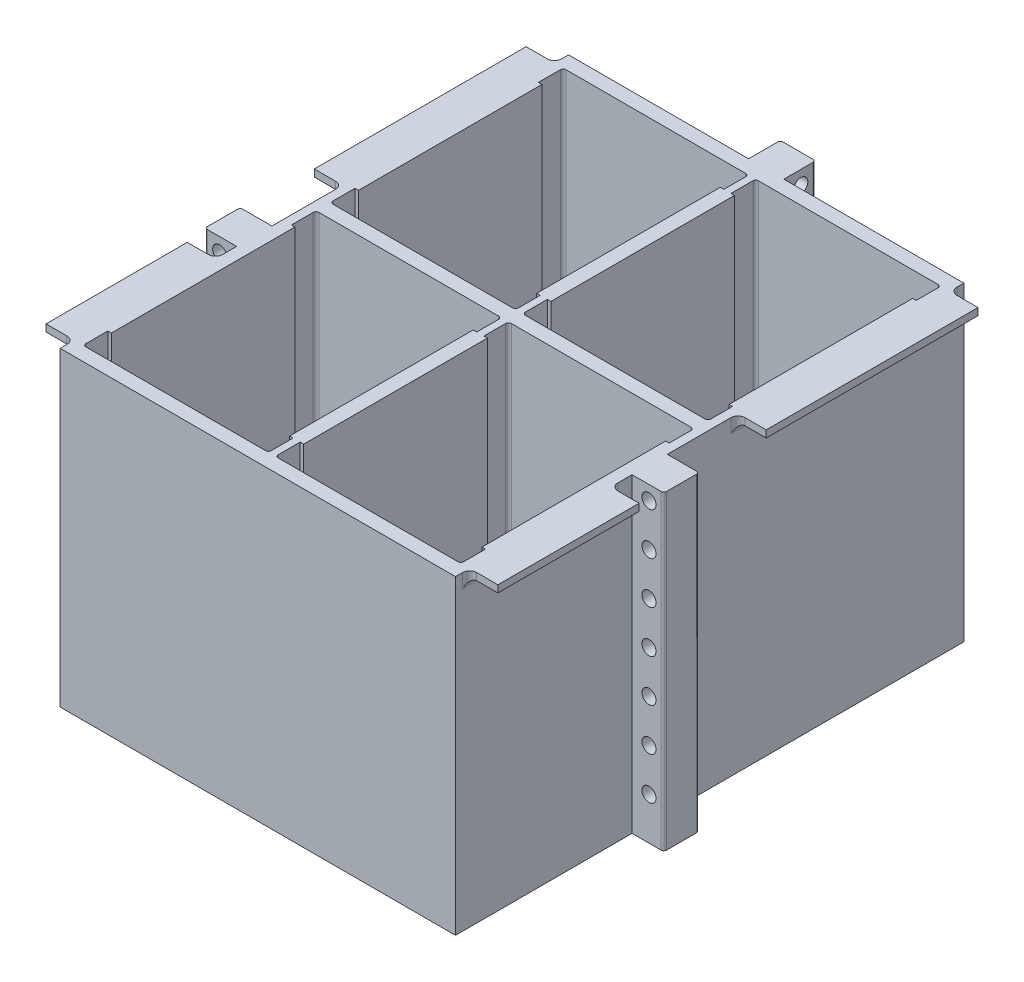
from build123d import *

# Parameters (mm, degrees)
BOSS_EXTRUDE1_DEPTH = 279.4
SKETCH2_R           = 6.35
CUT_EXTRUDE1_DEPTH  = 45.72
SKETCH3_R           = 6.35
CUT_EXTRUDE2_DEPTH  = 45.72
FILLET1_R           = 2.54
CUT_EXTRUDE3_DEPTH  = 274.32
FILLET2_R           = 2.54
SKETCH6_W           = 127
SKETCH6_H           = 6.35
BOSS_EXTRUDE2_DEPTH = 25.4
SKETCH8_W           = 190.5
SKETCH8_H           = 6.35
BOSS_EXTRUDE3_DEPTH = 25.4
FILLET3_R           = 6.35


with BuildPart() as part:
    # Sketch1 → Boss-Extrude1 (new body)
    with BuildSketch(Plane(origin=(0, 0, 0), x_dir=(1, 0, 0), z_dir=(0, 1, 0))):
        Polygon((-177.8, -228.6), (-31.75, -228.6), (31.75, -228.6), (177.8, -228.6), (177.8, -69.85), (206.375, -69.85), (206.375, -38.1), (177.8, -38.1), (177.8, 228.6), (15.875, 228.6), (15.875, 257.175), (-15.875, 257.175), (-15.875, 228.6), (-177.8, 228.6), (-177.8, -38.1), (-206.375, -38.1), (-206.375, -69.85), (-177.8, -69.85), align=None)
    extrude(amount=BOSS_EXTRUDE1_DEPTH)

    # Sketch2 → Cut-Extrude1 (cut)
    with BuildSketch(Plane.XY.offset(69.85)):
        with Locations((-193.04, 38.1)):
            Circle(SKETCH2_R)
        with Locations((-193.04, 76.2)):
            Circle(SKETCH2_R)
        with Locations((-193.04, 114.3)):
            Circle(SKETCH2_R)
        with Locations((-193.04, 152.4)):
            Circle(SKETCH2_R)
        with Locations((-193.04, 190.5)):
            Circle(SKETCH2_R)
        with Locations((-193.04, 228.6)):
            Circle(SKETCH2_R)
        with Locations((-193.04, 266.7)):
            Circle(SKETCH2_R)
        with Locations((193.04, 266.7)):
            Circle(SKETCH2_R)
        with Locations((193.04, 228.6)):
            Circle(SKETCH2_R)
        with Locations((193.04, 190.5)):
            Circle(SKETCH2_R)
        with Locations((193.04, 152.4)):
            Circle(SKETCH2_R)
        with Locations((193.04, 114.3)):
            Circle(SKETCH2_R)
        with Locations((193.04, 76.2)):
            Circle(SKETCH2_R)
        with Locations((193.04, 38.1)):
            Circle(SKETCH2_R)
    extrude(amount=-CUT_EXTRUDE1_DEPTH, mode=Mode.SUBTRACT)

    # Sketch3 → Cut-Extrude2 (cut)
    with BuildSketch(Plane.ZY.offset(15.875)):
        with Locations((-243.84, 38.1)):
            Circle(SKETCH3_R)
        with Locations((-243.84, 76.2)):
            Circle(SKETCH3_R)
        with Locations((-243.84, 114.3)):
            Circle(SKETCH3_R)
        with Locations((-243.84, 152.4)):
            Circle(SKETCH3_R)
        with Locations((-243.84, 190.5)):
            Circle(SKETCH3_R)
        with Locations((-243.84, 228.6)):
            Circle(SKETCH3_R)
        with Locations((-243.84, 266.7)):
            Circle(SKETCH3_R)
    extrude(amount=-CUT_EXTRUDE2_DEPTH, mode=Mode.SUBTRACT)

    # Fillet1
    fillet1_edges = [part.edges().sort_by_distance(p)[0] for p in [
        (206.375, 139.7, 69.85),
        (206.375, 139.7, 38.1),
        (15.875, 139.7, -257.175),
        (-15.875, 139.7, -257.175),
        (-206.375, 139.7, 69.85),
        (-206.375, 139.7, 38.1),
    ]]
    fillet(fillet1_edges, radius=FILLET1_R)

    # Sketch4 → Cut-Extrude3 (cut)
    with BuildSketch(Plane(origin=(0, 279.4, 0), x_dir=(1, 0, 0), z_dir=(0, 1, 0))):
        Polygon((-3.175, 215.9), (-169.8625, 215.9), (-169.8625, 193.675), (-166.6875, 193.675), (-166.6875, 28.575), (-169.8625, 28.575), (-169.8625, 6.35), (-3.175, 6.35), (-3.175, 28.575), (-6.35, 28.575), (-6.35, 193.675), (-3.175, 193.675), align=None)
        Polygon((3.175, 28.575), (6.35, 28.575), (6.35, 193.675), (3.175, 193.675), (3.175, 215.9), (169.8625, 215.9), (169.8625, 193.675), (166.6875, 193.675), (166.6875, 28.575), (169.8625, 28.575), (169.8625, 6.35), (3.175, 6.35), align=None)
        Polygon((3.175, -193.675), (3.175, -215.9), (169.8625, -215.9), (169.8625, -193.675), (166.6875, -193.675), (166.6875, -28.575), (169.8625, -28.575), (169.8625, -6.35), (3.175, -6.35), (3.175, -28.575), (6.35, -28.575), (6.35, -193.675), align=None)
        Polygon((-3.175, -193.675), (-3.175, -215.9), (-169.8625, -215.9), (-169.8625, -193.675), (-166.6875, -193.675), (-166.6875, -28.575), (-169.8625, -28.575), (-169.8625, -6.35), (-3.175, -6.35), (-3.175, -28.575), (-6.35, -28.575), (-6.35, -193.675), align=None)
    extrude(amount=-CUT_EXTRUDE3_DEPTH, mode=Mode.SUBTRACT)

    # Fillet2
    fillet2_edges = [part.edges().sort_by_distance(p)[0] for p in [
        (169.8625, 142.24, 215.9),
        (-3.175, 142.24, 215.9),
        (-169.8625, 142.24, 215.9),
        (3.175, 142.24, 215.9),
        (169.8625, 142.24, 6.35),
        (-3.175, 142.24, 6.35),
        (-169.8625, 142.24, 6.35),
        (3.175, 142.24, 6.35),
        (-3.175, 142.24, -6.35),
        (-169.8625, 142.24, -6.35),
        (-3.175, 142.24, -215.9),
        (-169.8625, 142.24, -215.9),
        (3.175, 142.24, -215.9),
        (169.8625, 142.24, -215.9),
        (169.8625, 142.24, -6.35),
        (3.175, 142.24, -6.35),
    ]]
    fillet(fillet2_edges, radius=FILLET2_R)

    # Sketch6 → Boss-Extrude2 (add)
    with BuildSketch(Plane(origin=(177.8, 0, 0), x_dir=(0, 0, -1), z_dir=(1, 0, 0))):
        with Locations((-152.4, 276.225)):
            Rectangle(SKETCH6_W, SKETCH6_H)
    boss_extrude2 = extrude(amount=BOSS_EXTRUDE2_DEPTH)

    # Mirror1: Boss-Extrude2 across plane
    add(boss_extrude2.mirror(Plane(origin=(0, 0, 0), x_dir=(0, 0, 1), z_dir=(1, 0, 0))))

    # Sketch8 → Boss-Extrude3 (add)
    with BuildSketch(Plane(origin=(177.8, 0, 0), x_dir=(0, 0, -1), z_dir=(1, 0, 0))):
        with Locations((120.65, 276.225)):
            Rectangle(SKETCH8_W, SKETCH8_H)
    boss_extrude3 = extrude(amount=BOSS_EXTRUDE3_DEPTH)

    # Mirror2: Boss-Extrude3 across plane
    add(boss_extrude3.mirror(Plane(origin=(0, 0, 0), x_dir=(0, 0, 1), z_dir=(1, 0, 0))))

    # Fillet3
    fillet3_edges = [part.edges().sort_by_distance(p)[0] for p in [
        (-177.8, 276.225, 88.9),
        (-177.8, 273.05, 152.4),
        (-177.8, 276.225, 215.9),
        (-177.8, 276.225, -25.4),
        (-177.8, 273.05, -120.65),
        (-177.8, 276.225, -215.9),
        (177.8, 276.225, -215.9),
        (177.8, 273.05, -120.65),
        (177.8, 276.225, -25.4),
        (177.8, 276.225, 88.9),
        (177.8, 276.225, 215.9),
        (177.8, 273.05, 152.4),
    ]]
    fillet(fillet3_edges, radius=FILLET3_R)


solid = part.part
